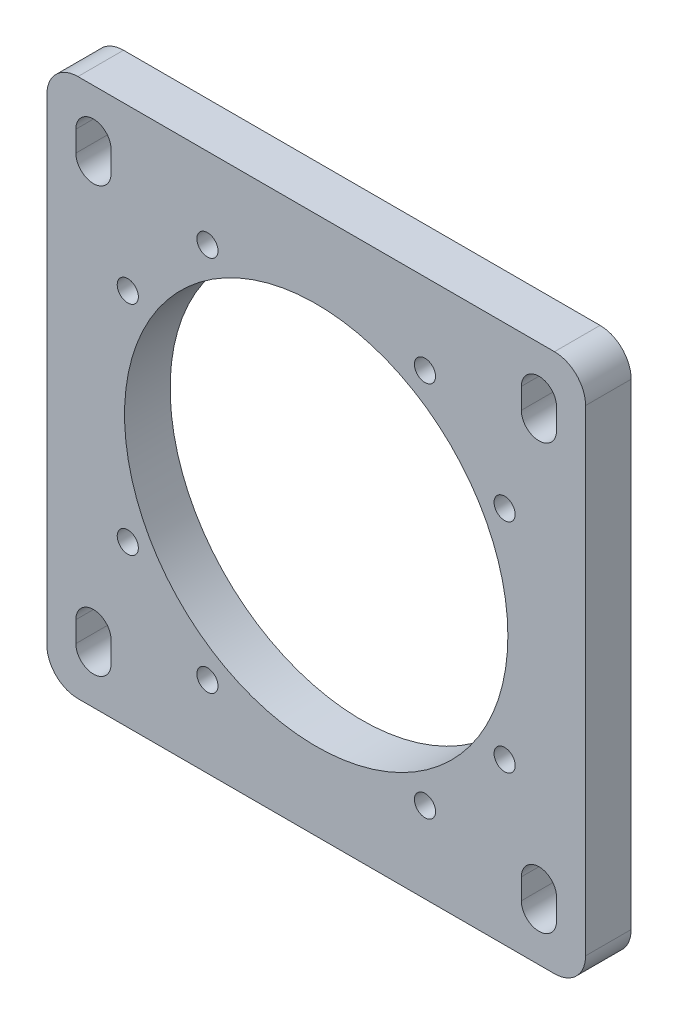
from build123d import *

# Parameters (mm, degrees)
SKETCH_1_W               = 260
SKETCH_1_H               = 260
EXTRUDE_1_DEPTH          = 22
FILLET_1_R               = 15
CUT_EXTRUDE_1_DEPTH      = 186.159390796
CUT_EXTRUDE_1_DEPTH_BACK = 186.159390796
SKETCH_2_R               = 92.5
SKETCH_2_R_2             = 5.1
CUT_EXTRUDE_2_DEPTH      = 186.159390796
CUT_EXTRUDE_2_DEPTH_BACK = 186.159390796


with BuildPart() as part:
    # ｽｹｯﾁ1 → ﾎﾞｽ - 押し出し1 (new body)
    with BuildSketch(Plane.XY):
        Rectangle(SKETCH_1_W, SKETCH_1_H)
    extrude(amount=EXTRUDE_1_DEPTH)

    # ﾌｨﾚｯﾄ1
    fillet_1_edges = [part.edges().sort_by_distance(p)[0] for p in [
        (-130, 130, 11),
        (130, 130, 11),
        (130, -130, 11),
        (-130, -130, 11),
    ]]
    fillet(fillet_1_edges, radius=FILLET_1_R)

    # ｽｹｯﾁ2 → ｶｯﾄ - 押し出し1 (cut, two sides: drawn at the far end of the back side and taken through both)
    with BuildSketch(Plane.XY.offset(-CUT_EXTRUDE_1_DEPTH_BACK)):
        Circle(SKETCH_2_R)
        with Locations((90.932667397, 52.5)):
            Circle(SKETCH_2_R_2)
        with Locations((52.5, 90.932667397)):
            Circle(SKETCH_2_R_2)
        with Locations((-52.5, 90.932667397)):
            Circle(SKETCH_2_R_2)
        with Locations((-90.932667397, 52.5)):
            Circle(SKETCH_2_R_2)
        with Locations((-90.932667397, -52.5)):
            Circle(SKETCH_2_R_2)
        with Locations((-52.5, -90.932667397)):
            Circle(SKETCH_2_R_2)
        with Locations((52.5, -90.932667397)):
            Circle(SKETCH_2_R_2)
        with Locations((90.932667397, -52.5)):
            Circle(SKETCH_2_R_2)
    extrude(amount=CUT_EXTRUDE_1_DEPTH + CUT_EXTRUDE_1_DEPTH_BACK, mode=Mode.SUBTRACT)

    # ｽｹｯﾁ3 → ｶｯﾄ - 押し出し2 (cut, two sides: drawn at the far end of the back side and taken through both)
    with BuildSketch(Plane.XY.offset(-CUT_EXTRUDE_2_DEPTH_BACK)):
        with BuildLine():
            Line((-116, -107.5), (-116, -97.5))
            ThreePointArc((-116, -97.5), (-107.5, -89), (-99, -97.5))
            Line((-99, -97.5), (-99, -107.5))
            ThreePointArc((-99, -107.5), (-107.5, -116), (-116, -107.5))
        make_face()
        with BuildLine():
            Line((-116, 97.5), (-116, 107.5))
            ThreePointArc((-116, 107.5), (-107.5, 116), (-99, 107.5))
            Line((-99, 107.5), (-99, 97.5))
            ThreePointArc((-99, 97.5), (-107.5, 89), (-116, 97.5))
        make_face()
        with BuildLine():
            Line((99, -107.5), (99, -97.5))
            ThreePointArc((99, -97.5), (107.5, -89), (116, -97.5))
            Line((116, -97.5), (116, -107.5))
            ThreePointArc((116, -107.5), (107.5, -116), (99, -107.5))
        make_face()
        with BuildLine():
            Line((99, 97.5), (99, 107.5))
            ThreePointArc((99, 107.5), (107.5, 116), (116, 107.5))
            Line((116, 107.5), (116, 97.5))
            ThreePointArc((116, 97.5), (107.5, 89), (99, 97.5))
        make_face()
    extrude(amount=CUT_EXTRUDE_2_DEPTH + CUT_EXTRUDE_2_DEPTH_BACK, mode=Mode.SUBTRACT)


solid = part.part
